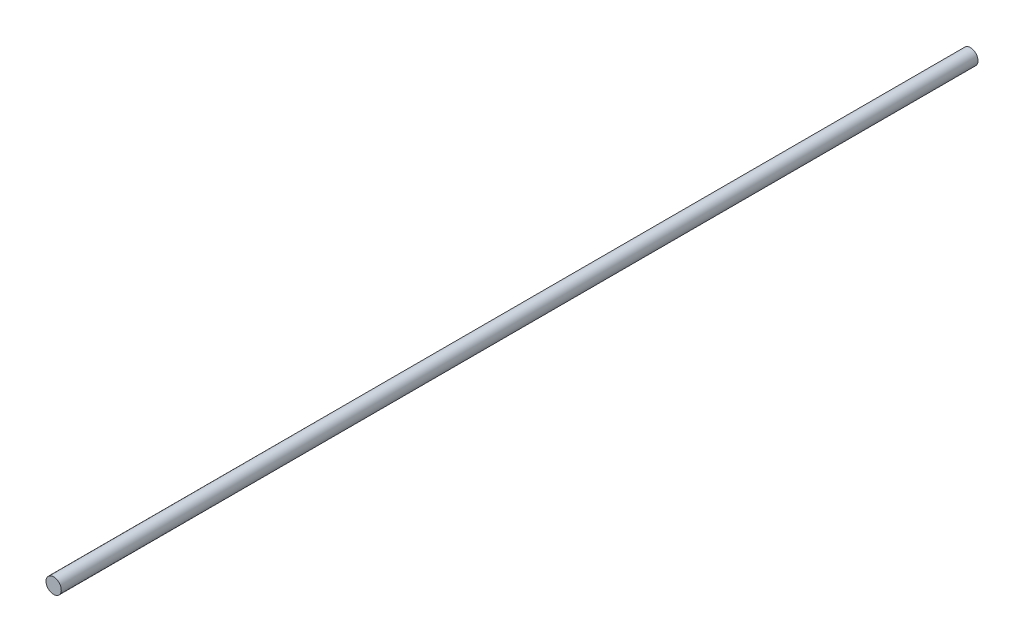
from build123d import *

# Parameters (mm, degrees)
SKETCH1_R           = 6.35
BOSS_EXTRUDE1_DEPTH = 762


with BuildPart() as part:
    # Sketch1 → Boss-Extrude1 (new body)
    with BuildSketch(Plane.XY):
        with Locations((0, 2.782338616)):
            Circle(SKETCH1_R)
    extrude(amount=BOSS_EXTRUDE1_DEPTH)


solid = part.part
